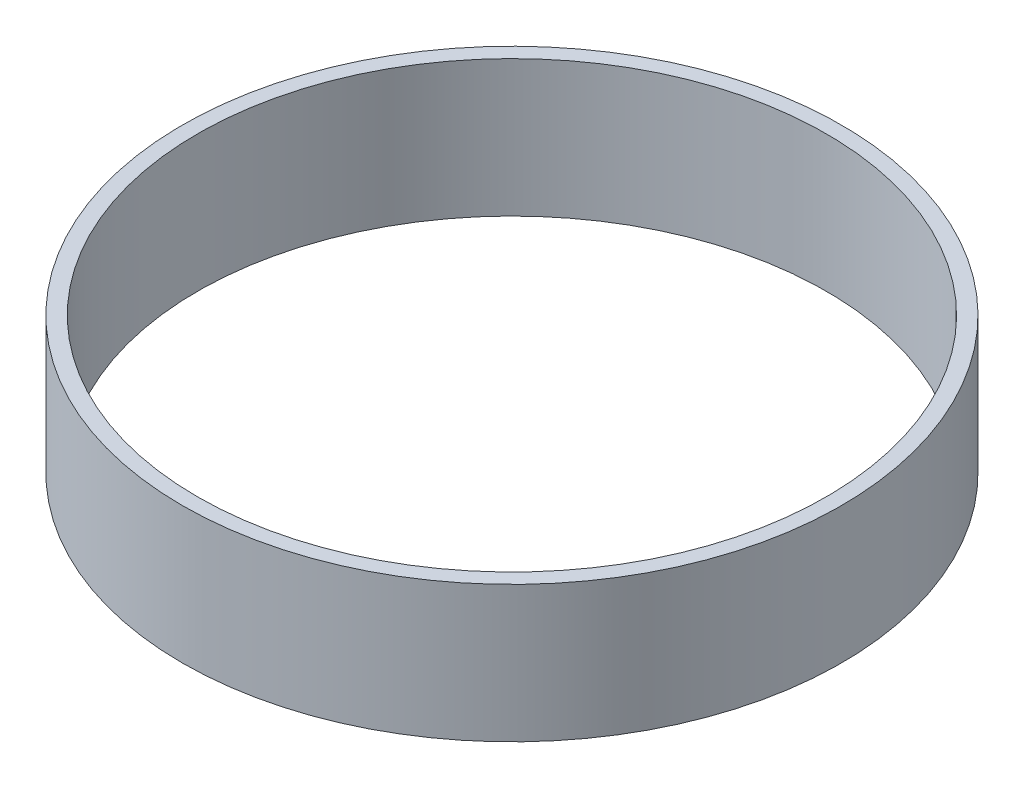
from build123d import *

# Parameters (mm, degrees)
SKETCH1_R           = 43.5
SKETCH1_R_2         = 41.5
BOSS_EXTRUDE1_DEPTH = 18


with BuildPart() as part:
    # Sketch1 → Boss-Extrude1 (new body)
    with BuildSketch(Plane(origin=(0, 0, 0), x_dir=(1, 0, 0), z_dir=(0, 1, 0))):
        with Locations(Location((0, 0, 0), (0, 0, 270))):
            Circle(SKETCH1_R)
        with Locations(Location((0, 0, 0), (0, 0, 270))):
            Circle(SKETCH1_R_2, mode=Mode.SUBTRACT)
    extrude(amount=BOSS_EXTRUDE1_DEPTH)


solid = part.part
